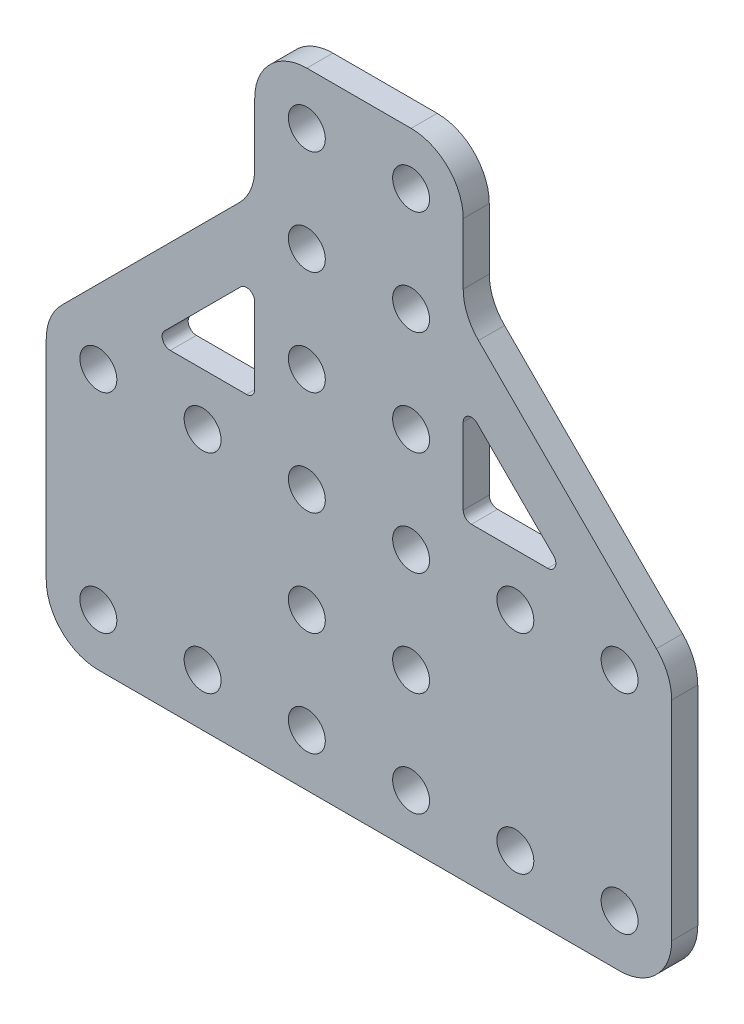
from build123d import *

# Parameters (mm, degrees)
SKETCH1_R           = 2.25
BOSS_EXTRUDE1_DEPTH = 3.175
FILLET1_R           = 6.35
FILLET2_R           = 1


with BuildPart() as part:
    # Sketch1 → Boss-Extrude1 (new body)
    with BuildSketch(Plane.XY):
        Polygon((0, 0), (-76.2, 0), (-76.2, 34.380256121), (-50.8, 59.780256121), (-50.8, 76.2), (-25.4, 76.2), (-25.4, 59.780256121), (0, 34.380256121), align=None)
        with Locations((-44.45, 57.15)):
            Circle(SKETCH1_R, mode=Mode.SUBTRACT)
        with Locations((-69.85, 6.35)):
            Circle(SKETCH1_R, mode=Mode.SUBTRACT)
        with Locations((-6.35, 6.35)):
            Circle(SKETCH1_R, mode=Mode.SUBTRACT)
        with Locations((-31.75, 44.45)):
            Circle(SKETCH1_R, mode=Mode.SUBTRACT)
        with Locations((-44.45, 44.45)):
            Circle(SKETCH1_R, mode=Mode.SUBTRACT)
        with Locations((-57.15, 6.35)):
            Circle(SKETCH1_R, mode=Mode.SUBTRACT)
        with Locations((-57.15, 31.75)):
            Circle(SKETCH1_R, mode=Mode.SUBTRACT)
        with Locations((-69.85, 31.75)):
            Circle(SKETCH1_R, mode=Mode.SUBTRACT)
        with Locations((-19.05, 6.35)):
            Circle(SKETCH1_R, mode=Mode.SUBTRACT)
        with Locations((-19.05, 31.75)):
            Circle(SKETCH1_R, mode=Mode.SUBTRACT)
        with Locations((-6.35, 31.75)):
            Circle(SKETCH1_R, mode=Mode.SUBTRACT)
        with Locations((-44.45, 31.75)):
            Circle(SKETCH1_R, mode=Mode.SUBTRACT)
        with Locations((-31.75, 31.75)):
            Circle(SKETCH1_R, mode=Mode.SUBTRACT)
        with Locations((-44.45, 19.05)):
            Circle(SKETCH1_R, mode=Mode.SUBTRACT)
        with Locations((-31.75, 19.05)):
            Circle(SKETCH1_R, mode=Mode.SUBTRACT)
        with Locations((-44.45, 6.35)):
            Circle(SKETCH1_R, mode=Mode.SUBTRACT)
        with Locations((-31.75, 6.35)):
            Circle(SKETCH1_R, mode=Mode.SUBTRACT)
        with Locations((-31.75, 57.15)):
            Circle(SKETCH1_R, mode=Mode.SUBTRACT)
        with Locations((-31.75, 69.85)):
            Circle(SKETCH1_R, mode=Mode.SUBTRACT)
        with Locations((-44.45, 69.85)):
            Circle(SKETCH1_R, mode=Mode.SUBTRACT)
        Polygon((-63.5, 38.1), (-50.8, 50.8), (-50.8, 38.1), align=None, mode=Mode.SUBTRACT)
        Polygon((-25.4, 50.8), (-25.4, 38.1), (-12.7, 38.1), align=None, mode=Mode.SUBTRACT)
    extrude(amount=BOSS_EXTRUDE1_DEPTH)

    # Fillet1
    fillet1_edges = [part.edges().sort_by_distance(p)[0] for p in [
        (0, 0, 1.5875),
        (-76.2, 0, 1.5875),
        (-76.2, 34.380256121, 1.5875),
        (-50.8, 59.780256121, 1.5875),
        (-50.8, 76.2, 1.5875),
        (-25.4, 76.2, 1.5875),
        (-25.4, 59.780256121, 1.5875),
        (0, 34.380256121, 1.5875),
    ]]
    fillet(fillet1_edges, radius=FILLET1_R)

    # Fillet2
    fillet2_edges = [part.edges().sort_by_distance(p)[0] for p in [
        (-63.5, 38.1, 1.5875),
        (-50.8, 38.1, 1.5875),
        (-50.8, 50.8, 1.5875),
        (-12.7, 38.1, 1.5875),
        (-25.4, 50.8, 1.5875),
        (-25.4, 38.1, 1.5875),
    ]]
    fillet(fillet2_edges, radius=FILLET2_R)


solid = part.part
